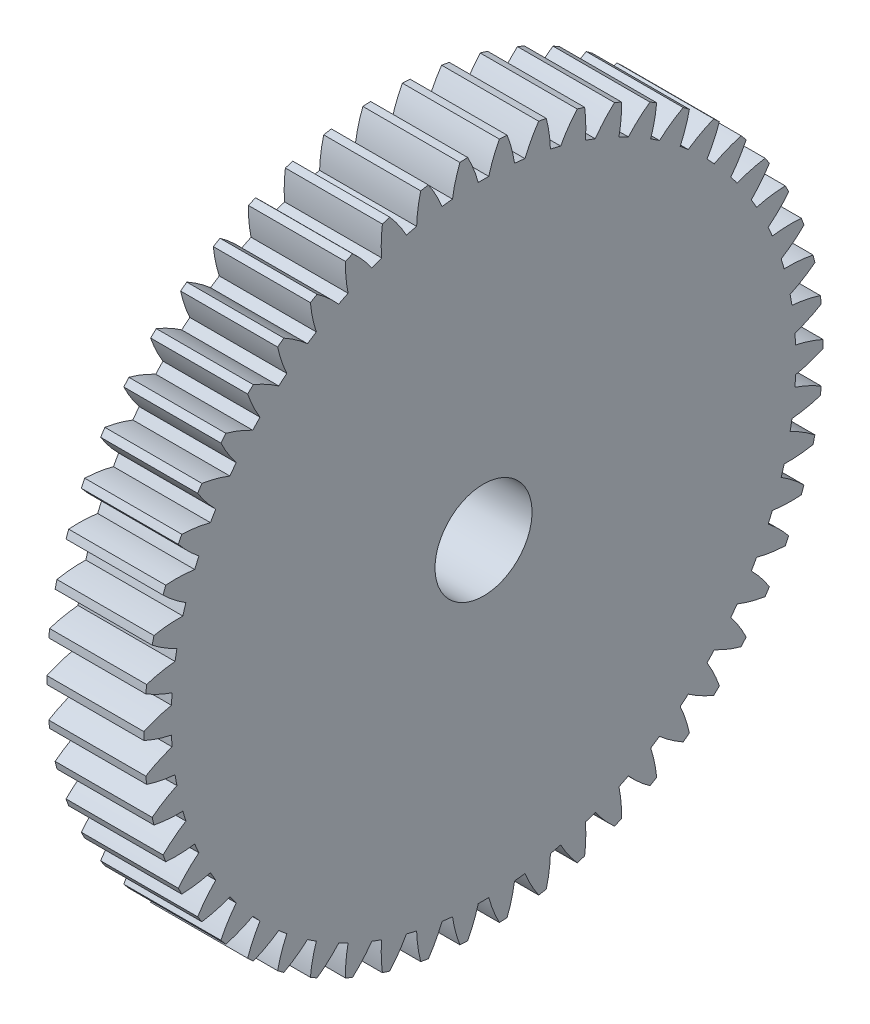
from build123d import *

# Parameters (mm, degrees)
BASPROSKE_W     = 8
BASPROSKE_H     = 28
TOOTHCUT_DEPTH  = 41.398019753
TEETHCUTS_COUNT = 54
TEETHCUTS_ANGLE = 353.333333333
BORSKE_R        = 4
BORE_DEPTH      = 50.0000508


with BuildPart() as part:
    # BasProSke → Base-Revolve (revolve)
    with BuildSketch(Plane(origin=(0, 0, 0), x_dir=(1, 0, 0), z_dir=(0, 1, 0)), mode=Mode.PRIVATE) as base_revolve_sk:
        with Locations((4, 14)):
            Rectangle(BASPROSKE_W, BASPROSKE_H)
    revolve(base_revolve_sk.sketch.rotate(Axis((-10, 0, 0), (1, 0, 0)), 180), axis=Axis((-10, 0, 0), (1, 0, 0)))

    # TooCutSke → ToothCut (cut, through all)
    with BuildSketch(Plane(origin=(0, 0, 0), x_dir=(0, 0, -1), z_dir=(1, 0, 0))):
        with BuildLine():
            ThreePointArc((0.434342569, 25.745336423), (0, 25.749), (-0.434342569, 25.745336423))
            ThreePointArc((-0.434342569, 25.745336423), (-0.815032242, 26.894686589), (-1.321977338, 27.994203348))
            ThreePointArc((-1.321977338, 27.994203348), (0, 28.0254), (1.321977338, 27.994203348))
            ThreePointArc((1.321977338, 27.994203348), (0.815032242, 26.894686589), (0.434342569, 25.745336423))
        make_face()
    toothcut = extrude(amount=TOOTHCUT_DEPTH, mode=Mode.SUBTRACT)

    # TeethCuts: ToothCut ×54 about axis
    teethcuts_axis = Axis((-10, 0, 0), (1, 0, 0))
    for i in range(1, TEETHCUTS_COUNT):
        add(toothcut.rotate(teethcuts_axis, i * TEETHCUTS_ANGLE / (TEETHCUTS_COUNT - 1)), mode=Mode.SUBTRACT)

    # BorSke → Bore (cut, symmetric)
    with BuildSketch(Plane(origin=(0, 0, 0), x_dir=(0, 0, -1), z_dir=(1, 0, 0))):
        with Locations(Location((0, 0, 0), (0, 0, 180))):
            Circle(BORSKE_R)
    extrude(amount=BORE_DEPTH, both=True, mode=Mode.SUBTRACT)


solid = part.part
